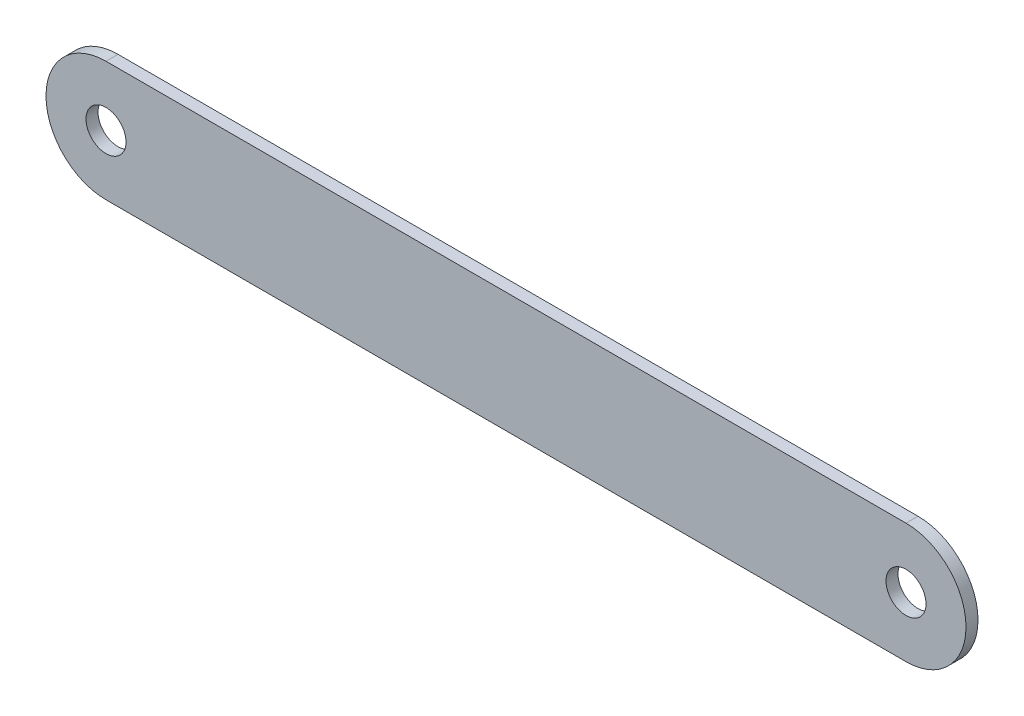
from build123d import *

# Parameters (mm, degrees)
SKETCH1_R           = 5
BOSS_EXTRUDE1_DEPTH = 3


with BuildPart() as part:
    # Sketch1 → Boss-Extrude1 (new body)
    with BuildSketch(Plane.XY):
        with BuildLine():
            Line((0, 15), (200, 15))
            ThreePointArc((200, 15), (215, 0), (200, -15))
            Line((200, -15), (0, -15))
            ThreePointArc((0, -15), (-15, 0), (0, 15))
        make_face()
        Circle(SKETCH1_R, mode=Mode.SUBTRACT)
        with Locations((200, 0)):
            Circle(SKETCH1_R, mode=Mode.SUBTRACT)
    extrude(amount=BOSS_EXTRUDE1_DEPTH)


solid = part.part
